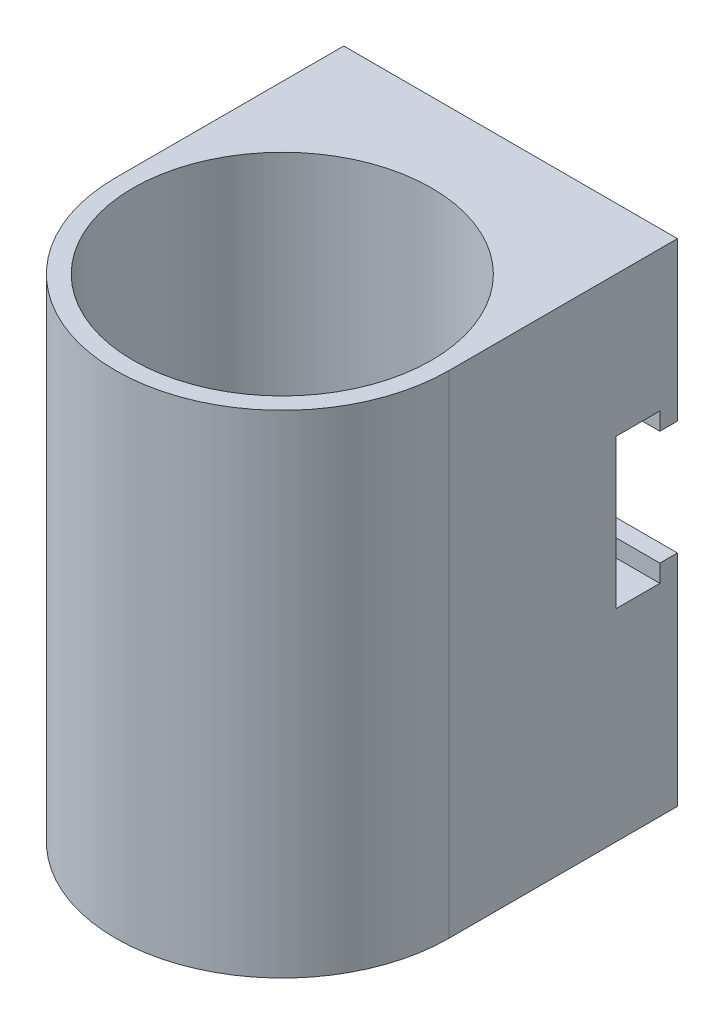
from build123d import *

# Parameters (mm, degrees)
SKETCH1_R           = 13.49375
BOSS_EXTRUDE1_DEPTH = 44.45
SKETCH2_R           = 15.08125
BOSS_EXTRUDE2_DEPTH = 1.5875
CUT_EXTRUDE1_DEPTH  = 58.545506449


with BuildPart() as part:
    # Sketch1 → Boss-Extrude1 (new body)
    with BuildSketch(Plane(origin=(0, 0, 0), x_dir=(1, 0, 0), z_dir=(0, 1, 0))):
        with BuildLine():
            Line((-15.08125, 0), (-15.08125, 20.6375))
            Line((-15.08125, 20.6375), (15.08125, 20.6375))
            Line((15.08125, 20.6375), (15.08125, 0))
            ThreePointArc((15.08125, 0), (0, -15.08125), (-15.08125, 0))
        make_face()
        with Locations(Location((0, 0, 0), (0, 0, 270))):
            Circle(SKETCH1_R, mode=Mode.SUBTRACT)
    extrude(amount=BOSS_EXTRUDE1_DEPTH)

    # Sketch2 → Boss-Extrude2 (add)
    with BuildSketch(Plane.XZ):
        Circle(SKETCH2_R)
    extrude(amount=-BOSS_EXTRUDE2_DEPTH)

    # Sketch3 → Cut-Extrude1 (cut, through all)
    with BuildSketch(Plane(origin=(15.08125, 0, 0), x_dir=(0, 0, -1), z_dir=(1, 0, 0))):
        Polygon((20.6375, 30.1625), (19.05, 30.1625), (19.05, 31.75), (15.08125, 31.75), (15.08125, 18.25625), (19.05, 18.25625), (19.05, 19.84375), (20.6375, 19.84375), align=None)
    extrude(amount=-CUT_EXTRUDE1_DEPTH, mode=Mode.SUBTRACT)


solid = part.part
